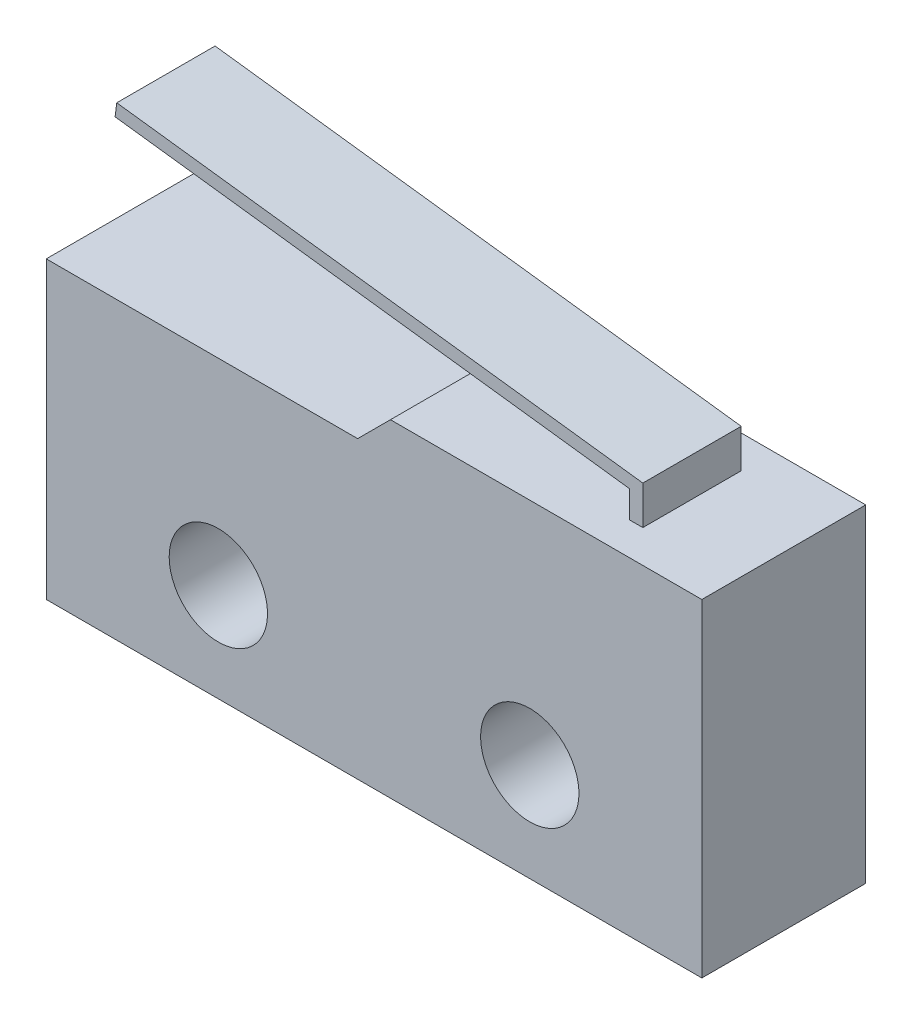
from build123d import *

# Parameters (mm, degrees)
BOSS_EXTRUDE1_DEPTH          = 2.5
F_3_0_3_DIAMETER_HOLE1_D     = 3
F_3_0_3_DIAMETER_HOLE1_DEPTH = 5
F_3_0_3_DIAMETER_HOLE1_TIP   = 0.901290929
BOSS_EXTRUDE2_DEPTH          = 1.5


with BuildPart() as part:
    # Sketch1 → Boss-Extrude1 (new, symmetric)
    with BuildSketch(Plane.XY):
        Polygon((-10, 4), (-0.5, 4), (0.5, 5), (10, 5), (10, -5), (-10, -5), align=None)
    extrude(amount=BOSS_EXTRUDE1_DEPTH, both=True)

    # Ø3.0 (3) Diameter Hole1
    with Locations(Plane(origin=(0, 0, -2.5), x_dir=(-1, 0, 0), z_dir=(0, 0, -1))):
        with Locations((-4.75, -2), (4.75, -2)):
            Hole(F_3_0_3_DIAMETER_HOLE1_D / 2, depth=F_3_0_3_DIAMETER_HOLE1_DEPTH)
            with Locations((0, 0, -(F_3_0_3_DIAMETER_HOLE1_DEPTH + F_3_0_3_DIAMETER_HOLE1_TIP / 2))):  # 118° drill point
                Cone(0, F_3_0_3_DIAMETER_HOLE1_D / 2, F_3_0_3_DIAMETER_HOLE1_TIP, mode=Mode.SUBTRACT)

    # Sketch5 → Boss-Extrude2 (add, symmetric)
    with BuildSketch(Plane.XY):
        Polygon((7.2, 5), (7.2, 6.176383421), (-8.849507866, 8.198431348), (-8.899507866, 7.801568652), (6.8, 5.823616579), (6.8, 5), align=None)
    extrude(amount=BOSS_EXTRUDE2_DEPTH, both=True)


solid = part.part
